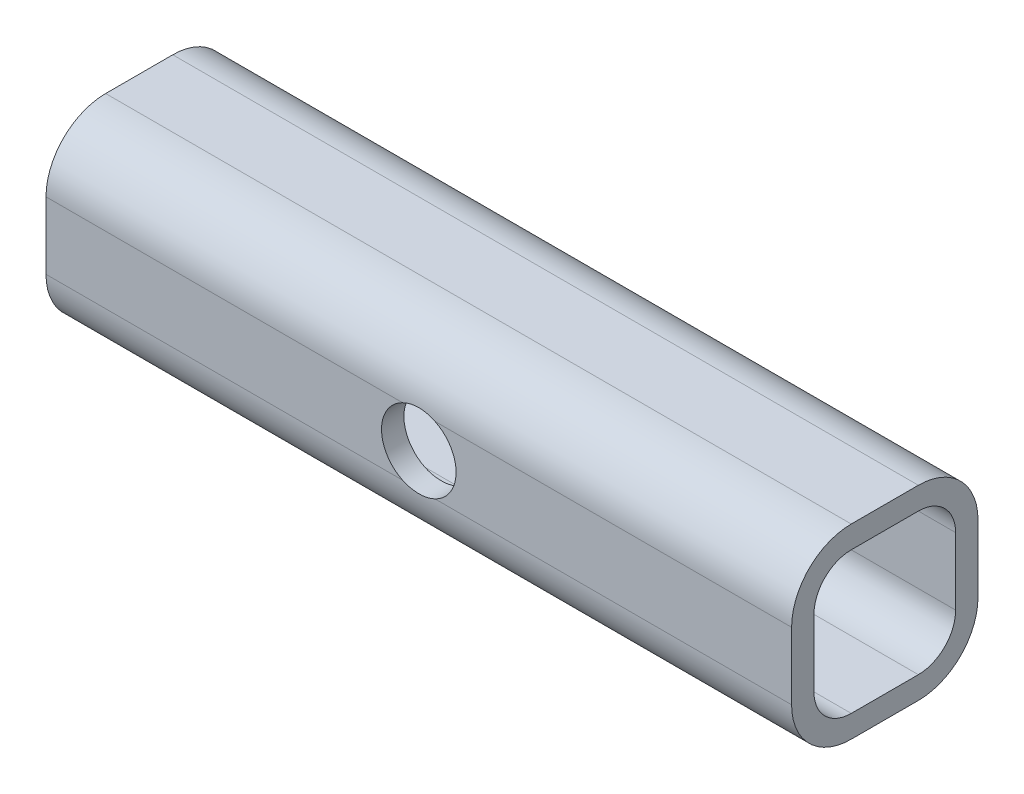
from build123d import *

# Parameters (mm, degrees)
CUT_EXTRUDE1_DEPTH      = 102.550480058
CUT_EXTRUDE1_DEPTH_BACK = 102.550480058
SKETCH3_R               = 5


with BuildPart() as part:
    # Sweep-Thin1: sweep along a path in Sketch1
    with BuildLine(Plane(origin=(0, 0, 0), x_dir=(1, 0, 0), z_dir=(0, 1, 0))) as sweep_thin1_path:
        Line((0, 0), (-100, 0))
    # Sketch2 → Sweep-Thin1 (sweep)
    with BuildSketch(Plane(origin=(0, 0, 0), x_dir=(0, 0, -1), z_dir=(1, 0, 0))):
        with BuildLine():
            Line((4.5, 12.5), (-4.5, 12.5))
            ThreePointArc((-4.5, 12.5), (-10.156854249, 10.156854249), (-12.5, 4.5))
            Line((-12.5, 4.5), (-12.5, -4.5))
            ThreePointArc((-12.5, -4.5), (-10.156854249, -10.156854249), (-4.5, -12.5))
            Line((-4.5, -12.5), (4.5, -12.5))
            ThreePointArc((4.5, -12.5), (10.156854249, -10.156854249), (12.5, -4.5))
            Line((12.5, -4.5), (12.5, 4.5))
            ThreePointArc((12.5, 4.5), (10.156854249, 10.156854249), (4.5, 12.5))
        make_face()
        with BuildLine():
            Line((4.5, 9.5), (-4.5, 9.5))
            ThreePointArc((-4.5, 9.5), (-8.035533906, 8.035533906), (-9.5, 4.5))
            Line((-9.5, 4.5), (-9.5, -4.5))
            ThreePointArc((-9.5, -4.5), (-8.035533906, -8.035533906), (-4.5, -9.5))
            Line((-4.5, -9.5), (4.5, -9.5))
            ThreePointArc((4.5, -9.5), (8.035533906, -8.035533906), (9.5, -4.5))
            Line((9.5, -4.5), (9.5, 4.5))
            ThreePointArc((9.5, 4.5), (8.035533906, 8.035533906), (4.5, 9.5))
        make_face(mode=Mode.SUBTRACT)
    sweep(path=sweep_thin1_path.line)

    # Sketch3 → Cut-Extrude1 (cut, two sides: drawn at the far end of the back side and taken through both)
    with BuildSketch(Plane.XY.offset(-CUT_EXTRUDE1_DEPTH_BACK)):
        with Locations(Location((-50, 0, 0), (0, 0, 64.158067237))):
            Circle(SKETCH3_R)
    extrude(amount=CUT_EXTRUDE1_DEPTH + CUT_EXTRUDE1_DEPTH_BACK, mode=Mode.SUBTRACT)


solid = part.part
